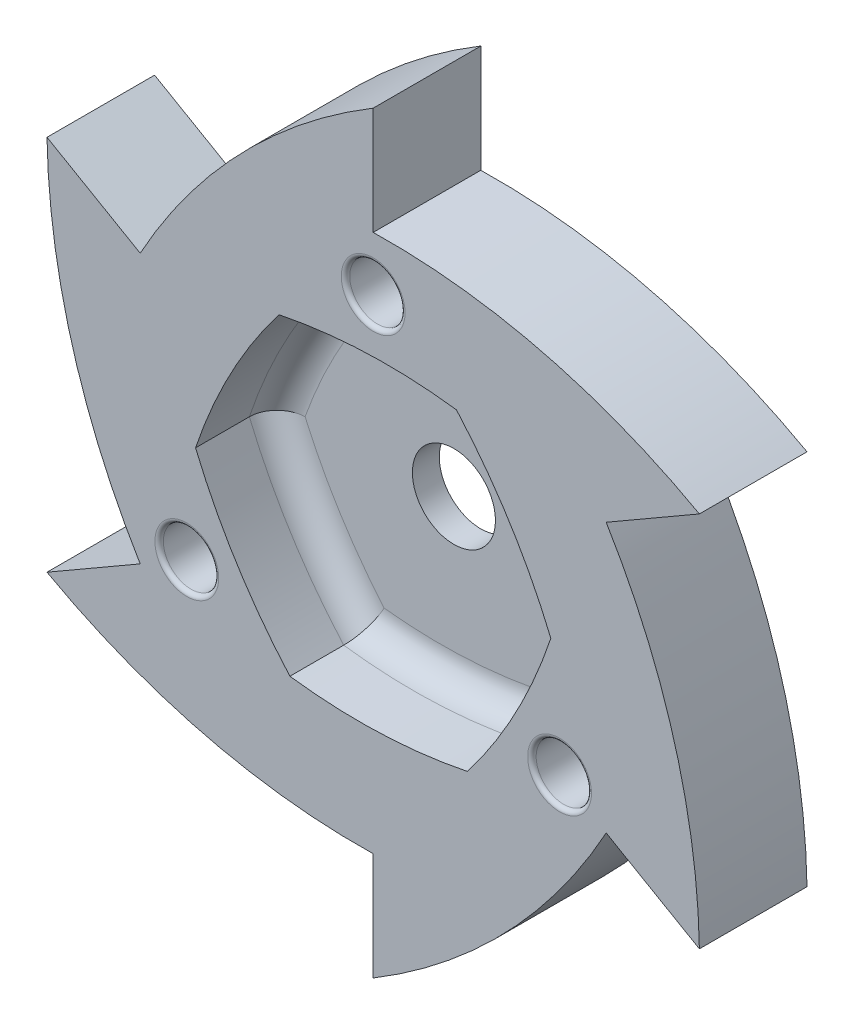
from build123d import *

# Parameters (mm, degrees)
BOSS_EXTRUDE1_DEPTH             = 6.35
BOSS_EXTRUDE1_DEPTH_BACK        = 6.35
BOSS_EXTRUDE2_START             = -12.7
BOSS_EXTRUDE2_DEPTH             = 12.7
CUT_EXTRUDE1_DEPTH              = 9.525
FILLET1_R                       = 3.175
W_0_386_DIAMETER_HOLE1_D        = 9.8044
F_9_64_0_14063_DIAMETER_HOLE1_D = 3.572002
CIRPATTERN1_COUNT               = 3
F_0_257_DIAMETER_HOLE1_D        = 6.5278
F_0_257_DIAMETER_HOLE1_DEPTH    = 9.652
FILLET2_R                       = 0.5


with BuildPart() as part:
    # Sketch1 → Boss-Extrude1 (new, two sides: drawn at the far end of the back side and taken through both)
    with BuildSketch(Plane.XY.offset(-BOSS_EXTRUDE1_DEPTH_BACK)):
        with BuildLine():
            Line((27.49630657, 15.875), (38.494829198, 22.225))
            ThreePointArc((38.494829198, 22.225), (19.878280804, 29.537115412), (0, 31.75))
            Line((0, 31.75), (0, 44.45))
            ThreePointArc((0, 44.45), (-15.640751899, 31.983653865), (-27.49630657, 15.875))
            Line((-27.49630657, 15.875), (-38.494829198, 22.225))
            ThreePointArc((-38.494829198, 22.225), (-35.519032703, 2.446538454), (-27.49630657, -15.875))
            Line((-27.49630657, -15.875), (-38.494829198, -22.225))
            ThreePointArc((-38.494829198, -22.225), (-19.878280804, -29.537115412), (0, -31.75))
            Line((0, -31.75), (0, -44.45))
            ThreePointArc((0, -44.45), (15.640751899, -31.983653865), (27.49630657, -15.875))
            Line((27.49630657, -15.875), (38.494829198, -22.225))
            ThreePointArc((38.494829198, -22.225), (35.519032703, -2.446538454), (27.49630657, 15.875))
        make_face()
        with BuildLine():
            ThreePointArc((-11.129967969, 17.779280801), (-16.817028225, 8.924127912), (-20.962292819, -0.749194604))
            ThreePointArc((-20.962292819, -0.749194604), (-16.137035591, -10.101909703), (-9.83232485, -18.528475405))
            ThreePointArc((-9.83232485, -18.528475405), (0.679992634, -19.026037615), (11.129967969, -17.779280801))
            ThreePointArc((11.129967969, -17.779280801), (16.817028225, -8.924127912), (20.962292819, 0.749194604))
            ThreePointArc((20.962292819, 0.749194604), (16.137035591, 10.101909703), (9.83232485, 18.528475405))
            ThreePointArc((9.83232485, 18.528475405), (-0.679992634, 19.026037615), (-11.129967969, 17.779280801))
        make_face(mode=Mode.SUBTRACT)
    extrude(amount=BOSS_EXTRUDE1_DEPTH + BOSS_EXTRUDE1_DEPTH_BACK)

    # Sketch3 → Boss-Extrude2 (add)
    with BuildSketch(Plane.XY.offset(6.35).offset(BOSS_EXTRUDE2_START)):
        with BuildLine():
            ThreePointArc((-11.129967969, 17.779280801), (-16.817028225, 8.924127912), (-20.962292819, -0.749194604))
            ThreePointArc((-20.962292819, -0.749194604), (-16.137035591, -10.101909703), (-9.83232485, -18.528475405))
            ThreePointArc((-9.83232485, -18.528475405), (0.679992634, -19.026037615), (11.129967969, -17.779280801))
            ThreePointArc((11.129967969, -17.779280801), (16.817028225, -8.924127912), (20.962292819, 0.749194604))
            ThreePointArc((20.962292819, 0.749194604), (16.137035591, 10.101909703), (9.83232485, 18.528475405))
            ThreePointArc((9.83232485, 18.528475405), (-0.679992634, 19.026037615), (-11.129967969, 17.779280801))
        make_face()
    extrude(amount=BOSS_EXTRUDE2_DEPTH)

    # Sketch3<2> → Cut-Extrude1 (cut)
    with BuildSketch(Plane.XY.offset(6.35)):
        with BuildLine():
            ThreePointArc((-11.129967969, 17.779280801), (-16.817028225, 8.924127912), (-20.962292819, -0.749194604))
            ThreePointArc((-20.962292819, -0.749194604), (-16.137035591, -10.101909703), (-9.83232485, -18.528475405))
            ThreePointArc((-9.83232485, -18.528475405), (0.679992634, -19.026037615), (11.129967969, -17.779280801))
            ThreePointArc((11.129967969, -17.779280801), (16.817028225, -8.924127912), (20.962292819, 0.749194604))
            ThreePointArc((20.962292819, 0.749194604), (16.137035591, 10.101909703), (9.83232485, 18.528475405))
            ThreePointArc((9.83232485, 18.528475405), (-0.679992634, 19.026037615), (-11.129967969, 17.779280801))
        make_face()
    extrude(amount=-CUT_EXTRUDE1_DEPTH, mode=Mode.SUBTRACT)

    # Fillet1
    fillet1_edges = [part.edges().sort_by_distance(p)[0] for p in [
        (-16.137035591, -10.101909703, -3.175),
        (0.679992634, -19.026037615, -3.175),
        (16.817028225, -8.924127912, -3.175),
        (16.137035591, 10.101909703, -3.175),
        (-0.679992634, 19.026037615, -3.175),
        (-16.817028225, 8.924127912, -3.175),
    ]]
    fillet(fillet1_edges, radius=FILLET1_R)

    # W (0.386) Diameter Hole1 (through all)
    with Locations(Plane.XY.offset(-3.175)):
        with Locations((0, 0)):
            Hole(W_0_386_DIAMETER_HOLE1_D / 2)

    # 9/64 (0.14063) Diameter Hole1 (through all)
    with Locations(Plane(origin=(0, 0, -6.35), x_dir=(-1, 0, 0), z_dir=(0, 0, -1))):
        with Locations((0, 25.4)):
            f_9_64_0_14063_diameter_hole1 = Hole(F_9_64_0_14063_DIAMETER_HOLE1_D / 2)

    # CirPattern1: 9/64 (0.14063) Diameter Hole1 ×3 about axis
    cirpattern1_axis = Axis((0, 0, -3.175), (0, 0, 1))
    for i in range(1, CIRPATTERN1_COUNT):
        add(f_9_64_0_14063_diameter_hole1.rotate(cirpattern1_axis, i * 360 / CIRPATTERN1_COUNT), mode=Mode.SUBTRACT)

    # F (0.257) Diameter Hole1
    with Locations(Plane.XY.offset(6.35)):
        with Locations((0, 25.4), (21.997045256, -12.7), (-21.997045256, -12.7)):
            Hole(F_0_257_DIAMETER_HOLE1_D / 2, depth=F_0_257_DIAMETER_HOLE1_DEPTH)

    # Fillet2
    fillet2_edges = [part.edges().sort_by_distance(p)[0] for p in [
        (25.260945256, -12.7, 6.35),
        (3.2639, 25.4, 6.35),
        (-18.733145256, -12.7, 6.35),
    ]]
    fillet(fillet2_edges, radius=FILLET2_R)


solid = part.part
